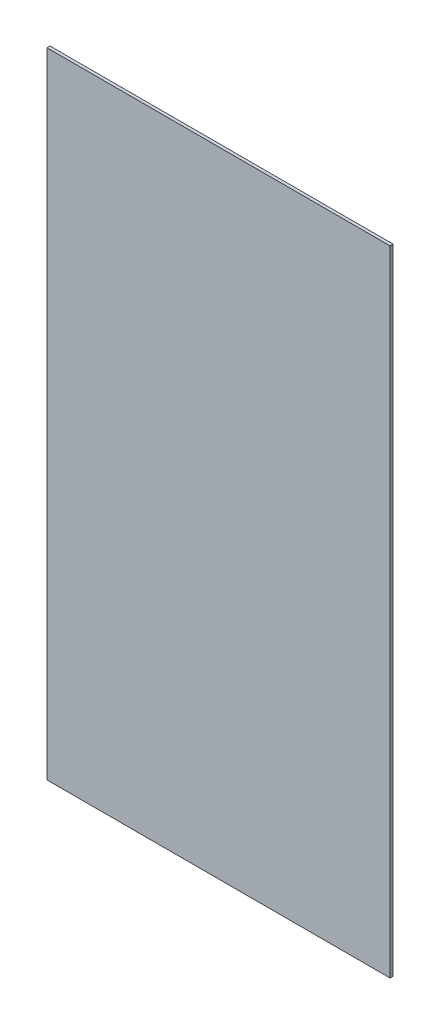
from build123d import *

# Parameters (mm, degrees)
DIFFUSER_SKETCH_W = 329.4
DIFFUSER_SKETCH_H = 608.8
DIFFUSER_DEPTH    = 1.45


with BuildPart() as part:
    # diffuser sketch → diffuser (new, symmetric)
    with BuildSketch(Plane.XY.offset(26.85)):
        Rectangle(DIFFUSER_SKETCH_W, DIFFUSER_SKETCH_H)
    extrude(amount=DIFFUSER_DEPTH, both=True)


solid = part.part
